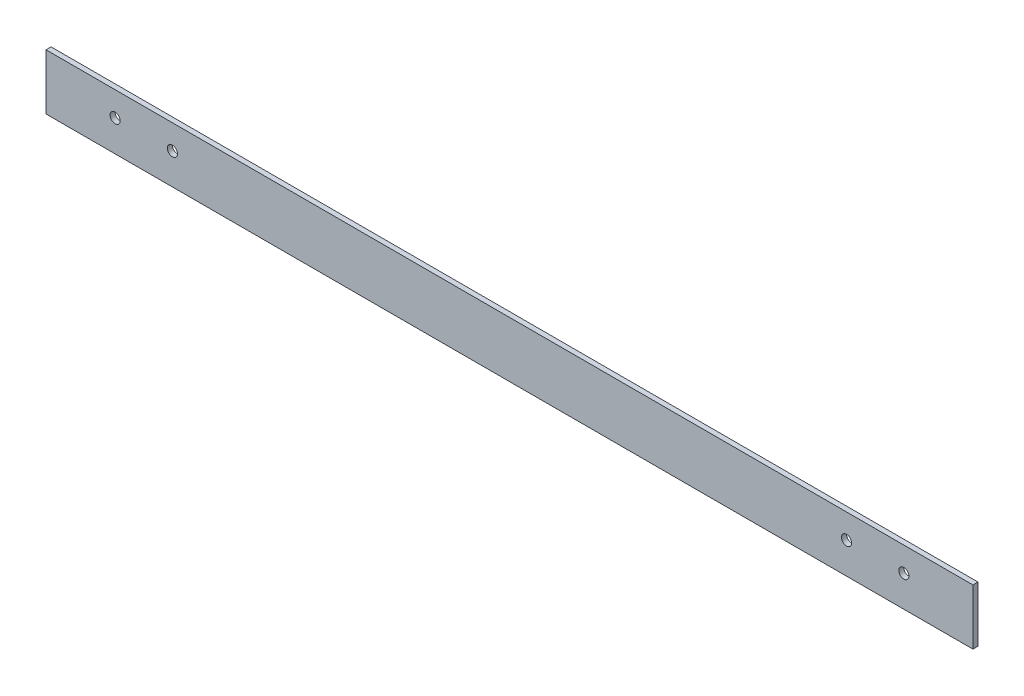
from build123d import *

# Parameters (mm, degrees)
SKETCH_1_W          = 550
SKETCH_1_H          = 33
EXTRUDE_1_DEPTH     = 3
SKETCH_2_R          = 3
CUT_EXTRUDE_1_DEPTH = 276.510889077


with BuildPart() as part:
    # 草图1 → 凸台-拉伸1 (new body)
    with BuildSketch(Plane.XY):
        Rectangle(SKETCH_1_W, SKETCH_1_H)
    extrude(amount=EXTRUDE_1_DEPTH)

    # 草图2 → 切除-拉伸1 (cut, through all)
    with BuildSketch(Plane.XY):
        with Locations((-234, 2)):
            Circle(SKETCH_2_R)
        with Locations((-200, 2)):
            Circle(SKETCH_2_R)
        with Locations(Location((200, 2, 0), (0, 0, 180))):
            Circle(SKETCH_2_R)
        with Locations(Location((234, 2, 0), (0, 0, 180))):
            Circle(SKETCH_2_R)
    extrude(amount=CUT_EXTRUDE_1_DEPTH, mode=Mode.SUBTRACT)


solid = part.part
